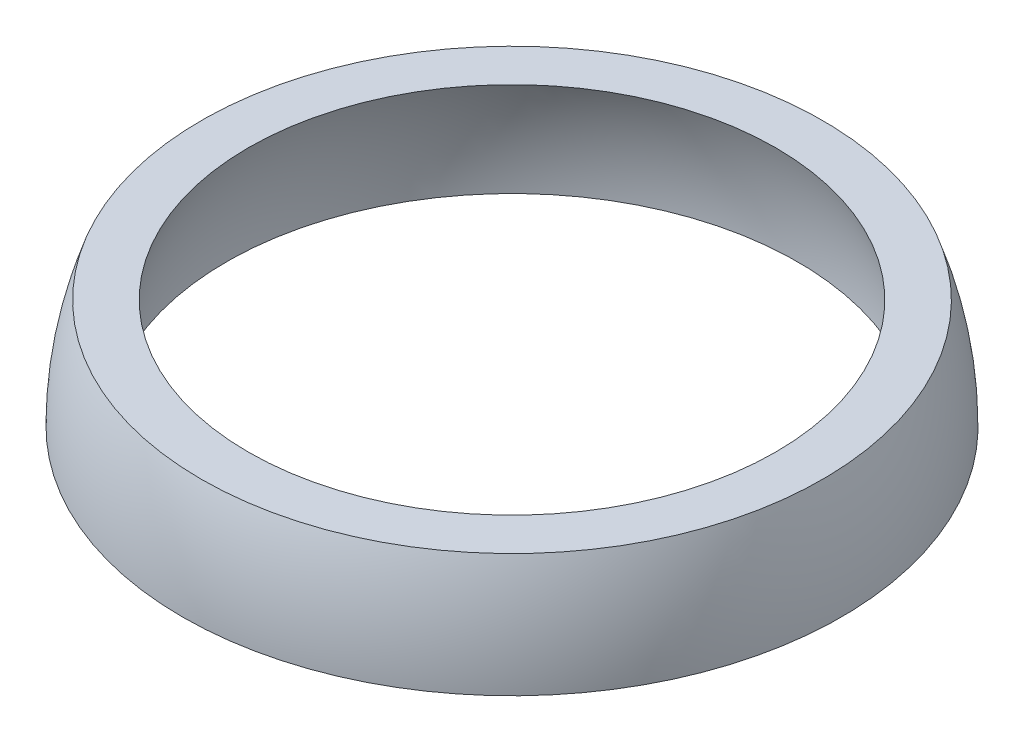
from build123d import *


with BuildPart() as part:
    # Sketch1 → Revolve2 (revolve)
    with BuildSketch(Plane.XY, mode=Mode.PRIVATE) as revolve2_sk:
        with BuildLine():
            Line((16.51, 0), (19.05, 0))
            ThreePointArc((19.05, 0), (18.775652561, 3.221392695), (17.960512242, 6.35))
            Line((17.960512242, 6.35), (15.24, 6.35))
            ThreePointArc((15.24, 6.35), (16.189386956, 3.237877391), (16.51, 0))
        make_face()
    revolve(revolve2_sk.sketch.rotate(Axis((0, 19.05, 0), (0, -1, 0)), 90), axis=Axis((0, 19.05, 0), (0, -1, 0)))


solid = part.part
